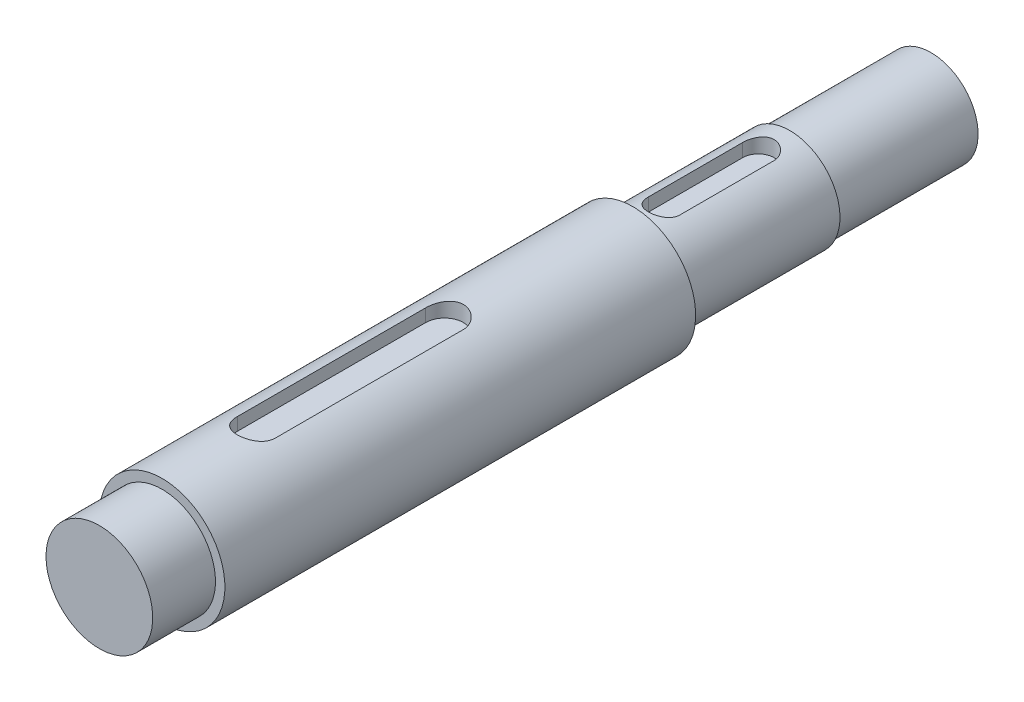
from build123d import *

# Parameters (mm, degrees)
CUT_EXTRUDE1_DEPTH  = 5
CUT_EXTRUDE11_DEPTH = 5


with BuildPart() as part:
    # Sketch1 → Revolve1 (revolve)
    with BuildSketch(Plane(origin=(0, 0, 0), x_dir=(1, 0, 0), z_dir=(0, 1, 0)), mode=Mode.PRIVATE) as revolve1_sk:
        Polygon((0, 0), (0, -265), (17, -265), (17, -245), (20, -245), (20, -95), (16, -95), (16, -45), (15, -45), (15, 0), align=None)
    revolve(revolve1_sk.sketch.rotate(Axis((0, 0, 0), (0, 0, 1)), 180), axis=Axis((0, 0, 0), (0, 0, 1)))

    # Sketch3 → Cut-Extrude1 (cut)
    with BuildSketch(Plane(origin=(2.233419524, 16, 45), x_dir=(0, 0, -1), z_dir=(0, -1, 0))):
        with BuildLine():
            Line((-10, 2.766580476), (-40, 2.766580476))
            ThreePointArc((-40, 2.766580476), (-45, -2.233419524), (-40, -7.233419524))
            Line((-40, -7.233419524), (-10, -7.233419524))
            ThreePointArc((-10, -7.233419524), (-5, -2.233419524), (-10, 2.766580476))
        make_face()
    extrude(amount=CUT_EXTRUDE1_DEPTH, mode=Mode.SUBTRACT)

    # Sketch31 → Cut-Extrude11 (cut)
    with BuildSketch(Plane(origin=(1.137793825, 20, 245), x_dir=(0, 0, 1), z_dir=(0, -1, 0))):
        with BuildLine():
            Line((-30, 7.137793825), (-90, 7.137793825))
            ThreePointArc((-90, 7.137793825), (-96, 1.137793825), (-90, -4.862206175))
            Line((-90, -4.862206175), (-30, -4.862206175))
            ThreePointArc((-30, -4.862206175), (-24, 1.137793825), (-30, 7.137793825))
        make_face()
    extrude(amount=CUT_EXTRUDE11_DEPTH, mode=Mode.SUBTRACT)


solid = part.part
